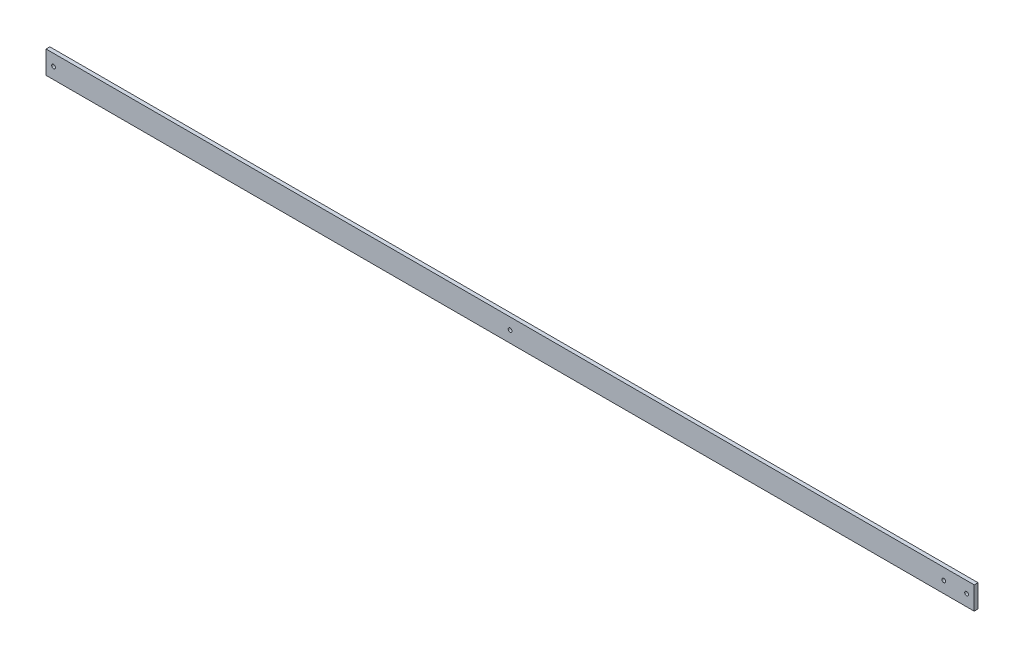
from build123d import *

# Parameters (mm, degrees)
SKETCH7_W           = 774.7
SKETCH7_H           = 19.05
SKETCH7_R           = 1.5875
BOSS_EXTRUDE1_DEPTH = 3.175


with BuildPart() as part:
    # Sketch7 → Boss-Extrude1 (new body)
    with BuildSketch(Plane.XY):
        with Locations((387.35, 9.525)):
            Rectangle(SKETCH7_W, SKETCH7_H)
        with Locations((6.35, 9.525)):
            Circle(SKETCH7_R, mode=Mode.SUBTRACT)
        with Locations((387.35, 9.525)):
            Circle(SKETCH7_R, mode=Mode.SUBTRACT)
        with Locations((768.35, 9.525)):
            Circle(SKETCH7_R, mode=Mode.SUBTRACT)
        with Locations((749.3, 9.525)):
            Circle(SKETCH7_R, mode=Mode.SUBTRACT)
    extrude(amount=BOSS_EXTRUDE1_DEPTH)


solid = part.part
